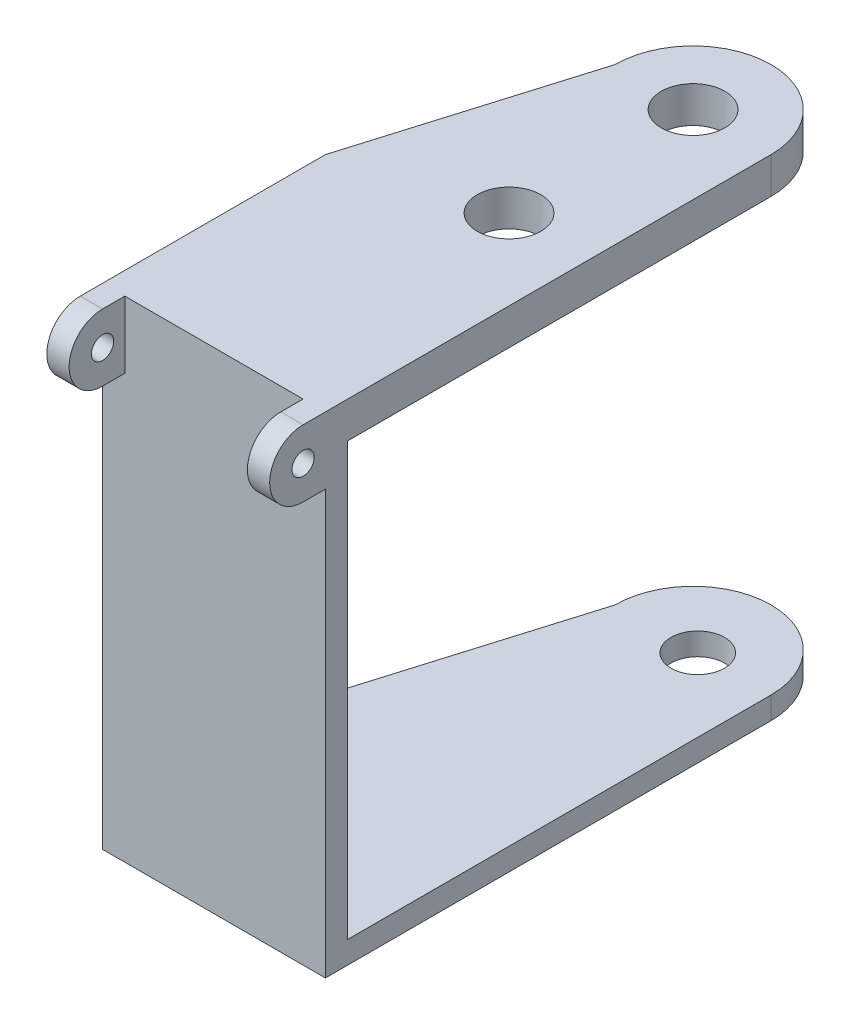
from build123d import *
from build123d.topology import SkipClean

# Parameters (mm, degrees)
SKETCH_2_W           = 5
SKETCH_2_H           = 10
EXTRUDE_1_DEPTH      = 0.5
CUT_EXTRUDE_1_DEPTH  = 1.5
EXTRUDE_3_DEPTH      = 0.5
SKETCH_8_R           = 0.6
CUT_EXTRUDE_2_DEPTH  = 0.5
SKETCH_12_W          = 5
SKETCH_12_H          = 0.5
EXTRUDE_4_DEPTH      = 10.5
SKETCH_14_W          = 5
SKETCH_14_H          = 0.5
EXTRUDE_5_DEPTH      = 10
SKETCH_16_W          = 5
SKETCH_16_H          = 0.5
CUT_EXTRUDE_3_DEPTH  = 10
CUT_EXTRUDE_4_DEPTH  = 10
EXTRUDE_START        = -0.5
EXTRUDE_6_DEPTH      = 0.5
SKETCH_19_R          = 0.6
CUT_EXTRUDE_5_DEPTH  = 0.5
SKETCH_23_W          = 0.5
SKETCH_23_H          = 1.5
EXTRUDE_7_DEPTH      = 0.5
EXTRUDE_9_DEPTH      = 0.5
SKETCH_25_R          = 0.25
CUT_EXTRUDE_6_DEPTH  = 0.5
CUT_EXTRUDE_START    = -0.5
SKETCH_28_R          = 0.25
CUT_EXTRUDE_7_DEPTH  = 0.5
SCALE_1_SCALE        = 3.181818182
SCALE_2_SCALE        = 0.771428571
CUT_EXTRUDE_8_DEPTH  = 10
SKETCH_30_R          = 1.75
CUT_EXTRUDE_9_DEPTH  = 10
EXTRUDE_10_DEPTH     = 3
SKETCH_37_R          = 4.295454545
EXTRUDE_11_DEPTH     = 3
CUT_EXTRUDE_START_2  = -3
SKETCH_38_R          = 1.75
CUT_EXTRUDE_10_DEPTH = 3
SKETCH_39_R          = 1.75
CUT_EXTRUDE_11_DEPTH = 3
SKETCH_41_W          = 46.80206249
SKETCH_41_H          = 2.589600393
CUT_EXTRUDE_13_DEPTH = 30.175477213
SKETCH_42_W          = 32.065343688
SKETCH_42_H          = 1.095167369
CUT_EXTRUDE_14_DEPTH = 30.175477212
EXTRUDE_START_2      = 0.77
EXTRUDE_12_DEPTH     = 0.77
CUT_EXTRUDE_15_REACH = 34.524
SKETCH_44_R          = 1.75


with BuildPart() as part:
    # 草图2 → 凸台-拉伸1 (new body)
    with BuildSketch(Plane(origin=(0, 0, 0), x_dir=(1, 0, 0), z_dir=(0, 1, 0))):
        Rectangle(SKETCH_2_W, SKETCH_2_H)
    extrude(amount=EXTRUDE_1_DEPTH)

    # 草图3 → 切除-拉伸1 (cut)
    with BuildSketch(Plane(origin=(0, 0.5, 0), x_dir=(1, 0, 0), z_dir=(0, 1, 0))):
        Polygon((-2.5, 0), (-1, 5), (-4.597388324, 7.155522044), (-6.097388324, 2.155522044), align=None)
    extrude(amount=-CUT_EXTRUDE_1_DEPTH, mode=Mode.SUBTRACT)

    # 草图6 → 凸台-拉伸3 (add)
    with BuildSketch(Plane.XZ):
        with BuildLine():
            Line((-1, -5), (2.5, -5))
            ThreePointArc((2.5, -5), (0.75, -6.75), (-1, -5))
        make_face()
    extrude(amount=-EXTRUDE_3_DEPTH)

    # 草图8 → 切除-拉伸2 (cut)
    with BuildSketch(Plane(origin=(0, 0.5, 0), x_dir=(1, 0, 0), z_dir=(0, 1, 0))):
        with Locations(Location((0.858368729, 4.996789463, 0), (0, 0, 270))):
            Circle(SKETCH_8_R)
    extrude(amount=-CUT_EXTRUDE_2_DEPTH, mode=Mode.SUBTRACT)

    # 草图12 → 凸台-拉伸4 (add)
    with BuildSketch(Plane.XZ):
        with Locations((0, 4.75)):
            Rectangle(SKETCH_12_W, SKETCH_12_H)
    extrude(amount=EXTRUDE_4_DEPTH)

    # 草图14 → 凸台-拉伸5 (add)
    with BuildSketch(Plane(origin=(0, 0, 4.5), x_dir=(-1, 0, 0), z_dir=(0, 0, -1))):
        with Locations((0, -10.25)):
            Rectangle(SKETCH_14_W, SKETCH_14_H)
    extrude(amount=EXTRUDE_5_DEPTH)

    # 草图16 → 切除-拉伸3 (cut)
    with BuildSketch(Plane(origin=(0, -10, 0), x_dir=(1, 0, 0), z_dir=(0, 1, 0))):
        with Locations((0, 5.25)):
            Rectangle(SKETCH_16_W, SKETCH_16_H)
    extrude(amount=-CUT_EXTRUDE_3_DEPTH, mode=Mode.SUBTRACT)

    # 草图17 → 切除-拉伸4 (cut)
    with BuildSketch(Plane(origin=(0, -10, 0), x_dir=(1, 0, 0), z_dir=(0, 1, 0))):
        Polygon((-1, 5), (-2.5, 0), (-4.860653069, 1.950314005), (-3.360653069, 6.950314005), align=None)
    extrude(amount=-CUT_EXTRUDE_4_DEPTH, mode=Mode.SUBTRACT)

    # 草图18 → 凸台-拉伸6 (add)
    with BuildSketch(Plane(origin=(0, -10, 0), x_dir=(1, 0, 0), z_dir=(0, 1, 0)).offset(EXTRUDE_START)):
        with BuildLine():
            Line((-1, 5), (2.5, 5))
            ThreePointArc((2.5, 5), (0.75, 6.75), (-1, 5))
        make_face()
    extrude(amount=EXTRUDE_6_DEPTH)

    # 草图19 → 切除-拉伸5 (cut)
    with BuildSketch(Plane(origin=(0, -10, 0), x_dir=(1, 0, 0), z_dir=(0, 1, 0))):
        with Locations(Location((0.858368729, 4.996789463, 0), (0, 0, 270))):
            Circle(SKETCH_19_R)
    extrude(amount=-CUT_EXTRUDE_5_DEPTH, mode=Mode.SUBTRACT)

    # 草图23 → 凸台-拉伸7 (add)
    with BuildSketch(Plane.XY.offset(5)):
        with Locations((2.25, -0.25)):
            Rectangle(SKETCH_23_W, SKETCH_23_H)
    extrude_7 = extrude(amount=EXTRUDE_7_DEPTH)

    # 草图24 → 凸台-拉伸9 (add)
    with BuildSketch(Plane(origin=(2.5, 0, 0), x_dir=(0, 0, -1), z_dir=(1, 0, 0))):
        with BuildLine():
            Line((-5.5, 0.5), (-5.5, -1))
            ThreePointArc((-5.5, -1), (-6.25, -0.25), (-5.5, 0.5))
        make_face()
    extrude_9 = extrude(amount=-EXTRUDE_9_DEPTH)

    # 草图25 → 切除-拉伸6 (cut)
    with BuildSketch(Plane(origin=(2.5, 0, 0), x_dir=(0, 0, -1), z_dir=(1, 0, 0))):
        with Locations((-5.5, -0.25)):
            Circle(SKETCH_25_R)
    extrude(amount=-CUT_EXTRUDE_6_DEPTH, mode=Mode.SUBTRACT)

    # 镜向1: 凸台-拉伸7, 凸台-拉伸9 across plane
    add(extrude_7.mirror(Plane(origin=(0, 0, 0), x_dir=(0, 0, 1), z_dir=(1, 0, 0))))
    add(extrude_9.mirror(Plane(origin=(0, 0, 0), x_dir=(0, 0, 1), z_dir=(1, 0, 0))))

    # 草图28 → 切除-拉伸7 (cut)
    with BuildSketch(Plane.ZY.offset(2.5).offset(CUT_EXTRUDE_START)):
        with Locations(Location((5.5, -0.25, 0), (0, 0, 180))):
            Circle(SKETCH_28_R)
    extrude(amount=CUT_EXTRUDE_7_DEPTH, mode=Mode.SUBTRACT)


with BuildPart() as part_1:
    # 缩放比例1: scaled about (0.132742616, -4.910605003, 1.535666779)
    add(part.part.scale(SCALE_1_SCALE).moved(Location((-0.289620253, 10.714047279, -3.3505457))))


with BuildPart() as part_2:
    # 缩放比例2: scaled about (0.132742617, -4.910605002, 1.53566678)
    add(part_1.part.scale(SCALE_2_SCALE).moved(Location((0.03034117, -1.122424, 0.35100955))))

    # 草图29 → 切除-拉伸8 (cut)
    with BuildSketch(Plane(origin=(0, 8.369970913, 0), x_dir=(1, 0, 0), z_dir=(0, 1, 0))):
        with BuildLine():
            ThreePointArc((3.397828922, 14.506424406), (1.647828922, 16.256424406), (-0.102171078, 14.506424406))
            Line((-0.102171078, 14.506424406), (0.441118704, 14.506424406))
            ThreePointArc((0.441118704, 14.506424406), (1.913824893, 15.97127127), (3.386531082, 14.506424406))
            Line((3.386531082, 14.506424406), (3.397828922, 14.506424406))
        make_face()
        with BuildLine():
            Line((0.441118704, 14.506424406), (-0.102171078, 14.506424406))
            ThreePointArc((-0.102171078, 14.506424406), (1.647828922, 12.756424406), (3.397828922, 14.506424406))
            Line((3.397828922, 14.506424406), (3.386531082, 14.506424406))
            ThreePointArc((3.386531082, 14.506424406), (3.386546895, 14.502484216), (3.386552166, 14.498543997))
            ThreePointArc((3.386552166, 14.498543997), (1.909884674, 13.025821995), (0.441118704, 14.506424406))
        make_face()
    extrude(amount=-CUT_EXTRUDE_8_DEPTH, mode=Mode.SUBTRACT)

    # 草图30 → 切除-拉伸9 (cut)
    with BuildSketch(Plane(origin=(0, 8.369970913, 0), x_dir=(1, 0, 0), z_dir=(0, 1, 0))):
        with Locations(Location((1.511995488, 4.506424406, 0), (0, 0, 270))):
            Circle(SKETCH_30_R)
    extrude(amount=-CUT_EXTRUDE_9_DEPTH, mode=Mode.SUBTRACT)

    # 草图33 → 凸台-拉伸10 (add)
    with BuildSketch(Plane(origin=(0, 8.369970913, 0), x_dir=(1, 0, 0), z_dir=(0, 1, 0))):
        Polygon((-5.102171078, -10.039030139), (-5.102171078, -11.266302866), (-6.329443805, -11.266302866), (-6.329443805, 2.233697134), (-2.647625624, 14.506424406), (5.943283467, 14.506424406), (5.943283467, -11.266302866), (4.71601074, -11.266302866), (4.71601074, -10.039030139), align=None)
    extrude(amount=EXTRUDE_10_DEPTH)

    # 草图37 → 凸台-拉伸11 (add)
    with BuildSketch(Plane(origin=(0, 8.369970913, 0), x_dir=(1, 0, 0), z_dir=(0, 1, 0))):
        with Locations((1.647828922, 14.506424406)):
            Circle(SKETCH_37_R)
    extrude(amount=EXTRUDE_11_DEPTH)

    # 草图38 → 切除-拉伸10 (cut)
    with SkipClean():  # the faces are left unmerged after this step: merging them gives an invalid solid
        with BuildSketch(Plane(origin=(0, 8.369970913, 0), x_dir=(-1, 0, 0), z_dir=(0, -1, 0)).offset(CUT_EXTRUDE_START_2)):
            with Locations(Location((-1.647828922, 14.506424406, 0), (0, 0, 270))):
                Circle(SKETCH_38_R)
        extrude(amount=CUT_EXTRUDE_10_DEPTH, mode=Mode.SUBTRACT)

    # 草图39 → 切除-拉伸11 (cut)
    with BuildSketch(Plane(origin=(0, 8.369970913, 0), x_dir=(-1, 0, 0), z_dir=(0, -1, 0)).offset(CUT_EXTRUDE_START_2)):
        with Locations(Location((-1.511995488, 4.506424406, 0), (0, 0, 270))):
            Circle(SKETCH_39_R)
    extrude(amount=CUT_EXTRUDE_11_DEPTH, mode=Mode.SUBTRACT)

    # 草图41 → 切除-拉伸13 (cut, through all)
    with BuildSketch(Plane(origin=(5.943283467, 0, 0), x_dir=(0, 0, -1), z_dir=(1, 0, 0))):
        with Locations((1.937836064, 10.437498382)):
            Rectangle(SKETCH_41_W, SKETCH_41_H)
    extrude(amount=-CUT_EXTRUDE_13_DEPTH, mode=Mode.SUBTRACT)

    # 草图42 → 切除-拉伸14 (cut, through all)
    with BuildSketch(Plane(origin=(5.943283467, 0, 0), x_dir=(0, 0, -1), z_dir=(1, 0, 0))):
        with Locations((4.766368978, 8.917554598)):
            Rectangle(SKETCH_42_W, SKETCH_42_H)
    extrude(amount=-CUT_EXTRUDE_14_DEPTH, mode=Mode.SUBTRACT)

    # 草图43 → 凸台-拉伸12 (add)
    with BuildSketch(Plane.XZ.offset(-7.142698186).offset(EXTRUDE_START_2)):
        with BuildLine():
            Line((-6.329443805, 8.811757412), (5.943283467, 8.811757412))
            Line((5.943283467, 8.811757412), (5.943283467, -14.506424406))
            ThreePointArc((5.943283467, -14.506424406), (4.685173959, -17.543769444), (1.647828922, -18.801878952))
            ThreePointArc((1.647828922, -18.801878952), (-1.389516115, -17.543769444), (-2.647625624, -14.506424406))
            Line((-2.647625624, -14.506424406), (-6.329443805, -2.233697134))
            Line((-6.329443805, -2.233697134), (-6.329443805, 8.811757412))
        make_face()
    extrude(amount=-EXTRUDE_12_DEPTH)

    # 草图44 → 切除-拉伸15 (cut, up to next)
    with BuildSketch(Plane(origin=(0, 7.142698186, 0), x_dir=(1, 0, 0), z_dir=(0, 1, 0)), mode=Mode.PRIVATE) as cut_extrude_15_sk1:
        with Locations(Location((1.511995488, 4.506424406, 0), (0, 0, 270))):
            Circle(SKETCH_44_R)
    cut_extrude_15_tool1 = extrude(cut_extrude_15_sk1.sketch, amount=-CUT_EXTRUDE_15_REACH, mode=Mode.PRIVATE) & part_2.part
    # 草图44 → 切除-拉伸15 (cut, up to next)
    with BuildSketch(Plane(origin=(0, 7.142698186, 0), x_dir=(1, 0, 0), z_dir=(0, 1, 0)), mode=Mode.PRIVATE) as cut_extrude_15_sk2:
        with Locations(Location((1.647828922, 14.506424406, 0), (0, 0, 270))):
            Circle(SKETCH_44_R)
    cut_extrude_15_tool2 = extrude(cut_extrude_15_sk2.sketch, amount=-CUT_EXTRUDE_15_REACH, mode=Mode.PRIVATE) & part_2.part
    add(cut_extrude_15_tool1.solids().sort_by_distance((1.511995, 7.142698, -4.506424))[0], mode=Mode.SUBTRACT)
    add(cut_extrude_15_tool2.solids().sort_by_distance((1.647829, 7.142698, -14.506424))[0], mode=Mode.SUBTRACT)


solid = part_2.part
